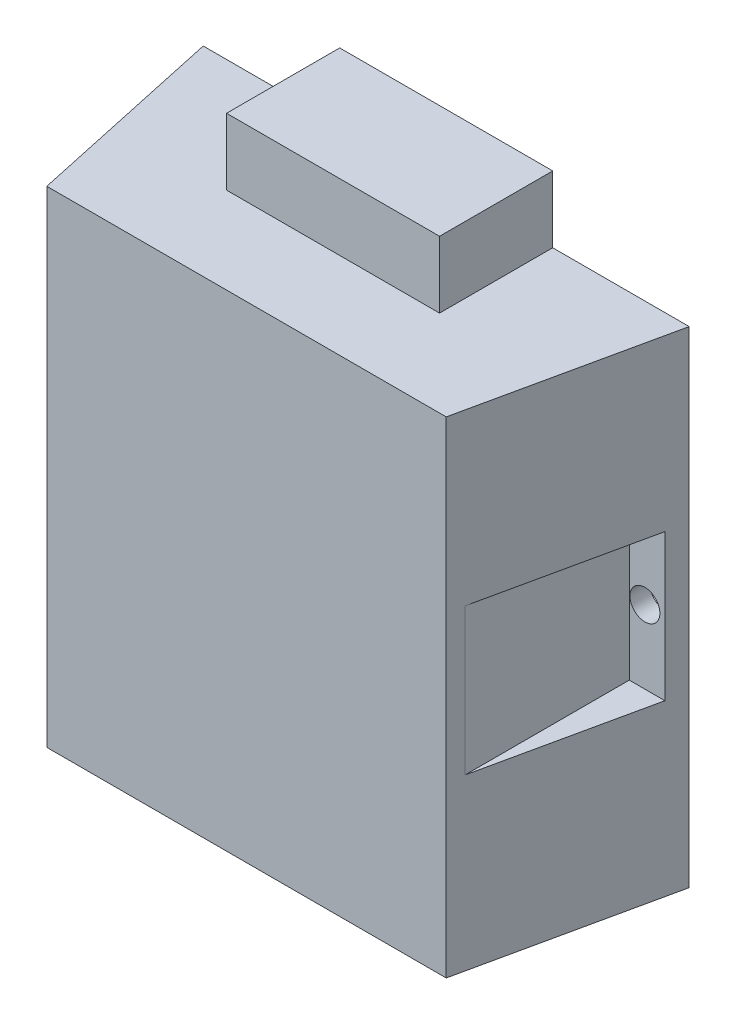
from build123d import *

# Parameters (mm, degrees)
EXTRUDE_1_DEPTH     = 73
SKETCH_2_W          = 32
SKETCH_2_H          = 17
EXTRUDE_2_DEPTH     = 10
SKETCH_3_W          = 6
SKETCH_3_H          = 22
CUT_EXTRUDE_1_DEPTH = 95.605760924
SKETCH_4_R          = 2.25
CUT_EXTRUDE_2_DEPTH = 10


with BuildPart() as part:
    # 草图1 → 凸台-拉伸1 (new body)
    with BuildSketch(Plane(origin=(0, 0, 0), x_dir=(1, 0, 0), z_dir=(0, 1, 0))):
        Polygon((-36.5, 30), (36.5, 30), (30, 0), (-30, 0), align=None)
    extrude(amount=EXTRUDE_1_DEPTH)

    # 草图2 → 凸台-拉伸2 (add)
    with BuildSketch(Plane(origin=(0, 73, 0), x_dir=(1, 0, 0), z_dir=(0, 1, 0))):
        with Locations((0, 21.5)):
            Rectangle(SKETCH_2_W, SKETCH_2_H)
    extrude(amount=EXTRUDE_2_DEPTH)

    # 草图3 → 切除-拉伸1 (cut, through all)
    with BuildSketch(Plane(origin=(0, 0, -27), x_dir=(-1, 0, 0), z_dir=(0, 0, -1))):
        with Locations((-33.5, 36.5)):
            Rectangle(SKETCH_3_W, SKETCH_3_H)
        with Locations((33.5, 36.5)):
            Rectangle(SKETCH_3_W, SKETCH_3_H)
    extrude(amount=-CUT_EXTRUDE_1_DEPTH, mode=Mode.SUBTRACT)

    # 草图4 → 切除-拉伸2 (cut)
    with BuildSketch(Plane.XY.offset(-27)):
        with Locations((32.85, 36.5)):
            Circle(SKETCH_4_R)
        with Locations((-32.85, 36.5)):
            Circle(SKETCH_4_R)
    extrude(amount=-CUT_EXTRUDE_2_DEPTH, mode=Mode.SUBTRACT)


solid = part.part
